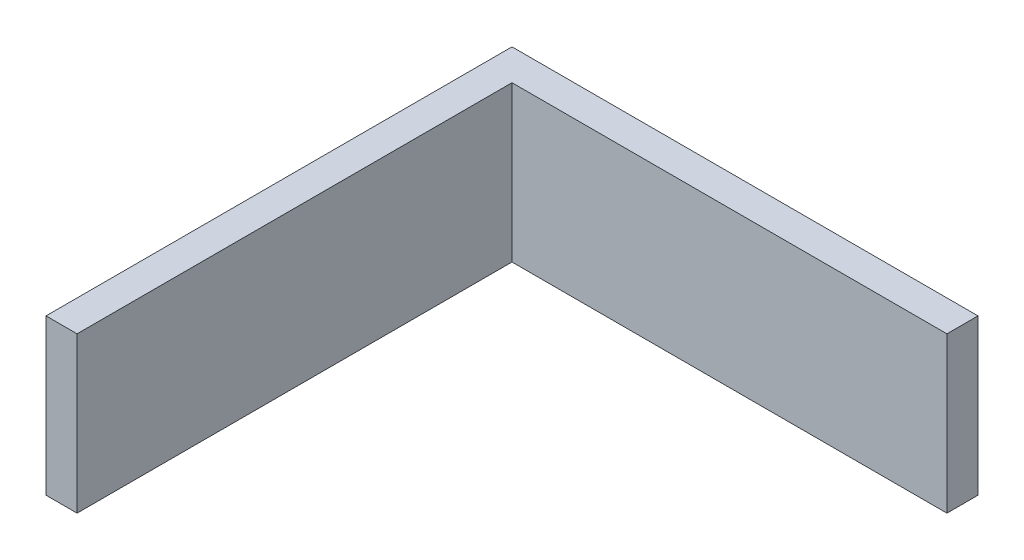
from build123d import *

# Parameters (mm, degrees)
SKETCH1_W           = 2
SKETCH1_H           = 30
SKETCH1_W_2         = 28
SKETCH1_H_2         = 2
BOSS_EXTRUDE1_DEPTH = 10


with BuildPart() as part:
    # Sketch1 → Boss-Extrude1 (new body)
    with BuildSketch(Plane(origin=(0, 0, 0), x_dir=(1, 0, 0), z_dir=(0, 1, 0))):
        with Locations((-1, -15)):
            Rectangle(SKETCH1_W, SKETCH1_H)
        with Locations((14, -1)):
            Rectangle(SKETCH1_W_2, SKETCH1_H_2)
    extrude(amount=BOSS_EXTRUDE1_DEPTH)


solid = part.part
